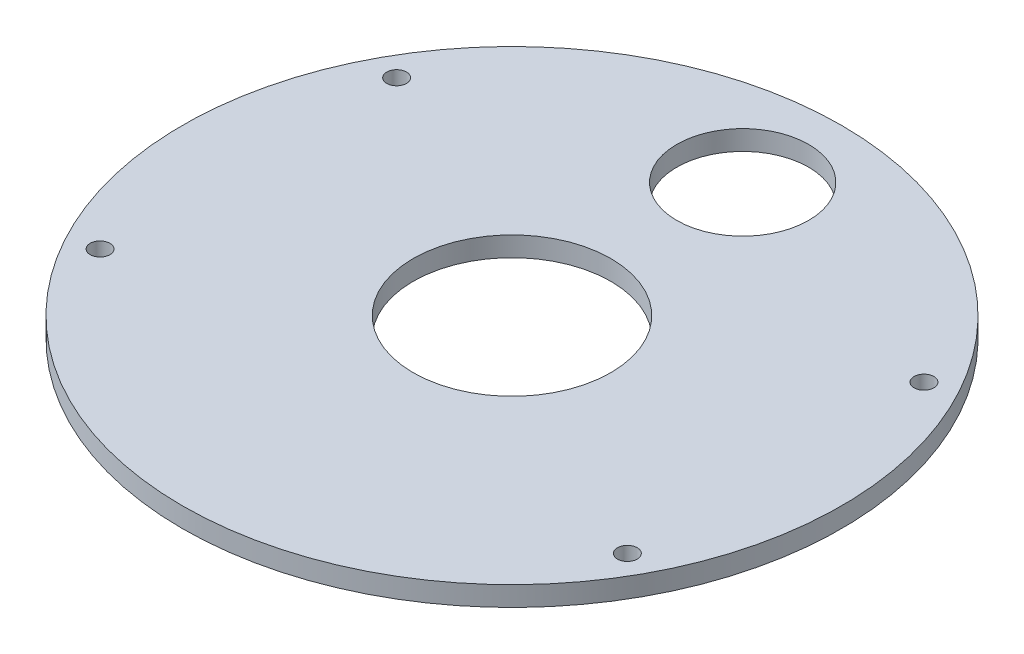
from build123d import *

# Parameters (mm, degrees)
SKETCH1_R           = 50
SKETCH1_R_2         = 1.5
BOSS_EXTRUDE1_DEPTH = 3
SKETCH2_R           = 15
CUT_EXTRUDE1_DEPTH  = 10
SKETCH3_R           = 10
CUT_EXTRUDE2_DEPTH  = 10


with BuildPart() as part:
    # Sketch1 → Boss-Extrude1 (new body)
    with BuildSketch(Plane(origin=(0, 0, 0), x_dir=(1, 0, 0), z_dir=(0, 1, 0))):
        with Locations(Location((0, 0, 0), (0, 0, 270))):
            Circle(SKETCH1_R)
        with Locations(Location((-40, 22.5, 0), (0, 0, 270))):
            Circle(SKETCH1_R_2, mode=Mode.SUBTRACT)
        with Locations(Location((40, 22.5, 0), (0, 0, 270))):
            Circle(SKETCH1_R_2, mode=Mode.SUBTRACT)
        with Locations(Location((40, -22.5, 0), (0, 0, 270))):
            Circle(SKETCH1_R_2, mode=Mode.SUBTRACT)
        with Locations(Location((-40, -22.5, 0), (0, 0, 270))):
            Circle(SKETCH1_R_2, mode=Mode.SUBTRACT)
    extrude(amount=BOSS_EXTRUDE1_DEPTH)

    # Sketch2 → Cut-Extrude1 (cut)
    with BuildSketch(Plane(origin=(0, 3, 0), x_dir=(1, 0, 0), z_dir=(0, 1, 0))):
        with Locations(Location((0, 0, 0), (0, 0, 270))):
            Circle(SKETCH2_R)
    extrude(amount=-CUT_EXTRUDE1_DEPTH, mode=Mode.SUBTRACT)

    # Sketch3 → Cut-Extrude2 (cut)
    with BuildSketch(Plane.XZ):
        with Locations(Location((0, -35, 0), (0, 0, 270))):
            Circle(SKETCH3_R)
    extrude(amount=-CUT_EXTRUDE2_DEPTH, mode=Mode.SUBTRACT)


solid = part.part
